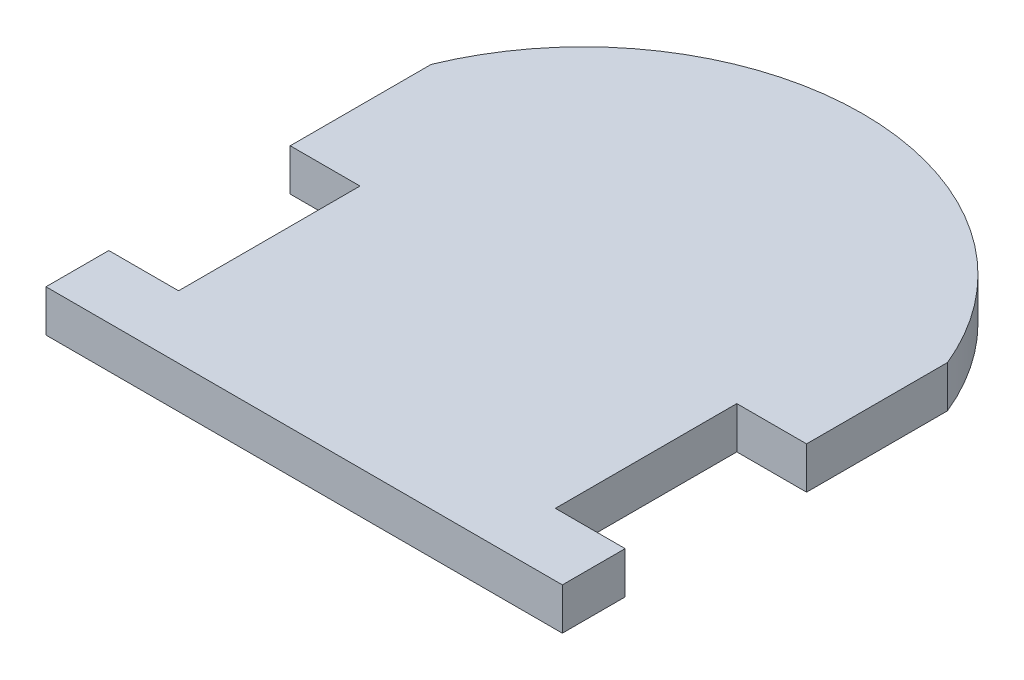
from build123d import *

# Parameters (mm, degrees)
BOSS_EXTRUDE1_DEPTH = 3
SKETCH2_W           = 5
SKETCH2_H           = 13
CUT_EXTRUDE2_DEPTH  = 10


with BuildPart() as part:
    # Sketch1 → Boss-Extrude1 (new body)
    with BuildSketch(Plane(origin=(0, 0, 0), x_dir=(1, 0, 0), z_dir=(0, 1, 0))):
        with BuildLine():
            ThreePointArc((18.5, 7.599342077), (0, 20), (-18.5, 7.599342077))
            Line((-18.5, 7.599342077), (-18.5, -20))
            Line((-18.5, -20), (18.5, -20))
            Line((18.5, -20), (18.5, 7.599342077))
        make_face()
    extrude(amount=BOSS_EXTRUDE1_DEPTH)

    # Sketch2 → Cut-Extrude2 (cut)
    with BuildSketch(Plane(origin=(0, 3, 0), x_dir=(1, 0, 0), z_dir=(0, 1, 0))):
        with Locations((-16, -9)):
            Rectangle(SKETCH2_W, SKETCH2_H)
        with Locations((16, -9)):
            Rectangle(SKETCH2_W, SKETCH2_H)
    extrude(amount=-CUT_EXTRUDE2_DEPTH, mode=Mode.SUBTRACT)


solid = part.part
